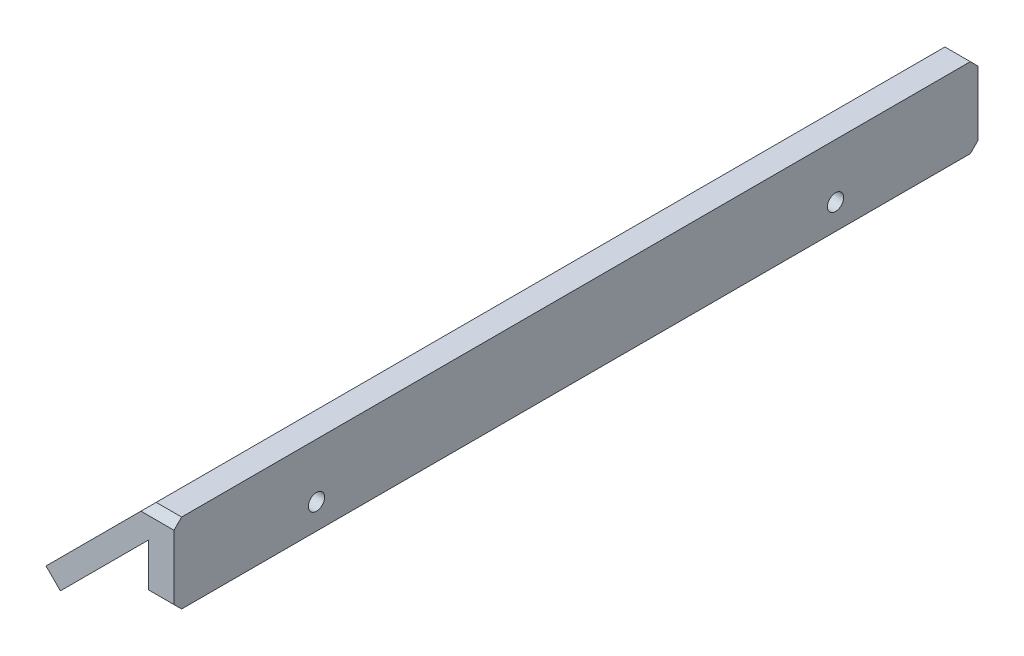
from build123d import *

# Parameters (mm, degrees)
EXTRUDE_1_DEPTH     = 158
SKETCH_2_R          = 1.6
CUT_EXTRUDE_1_DEPTH = 27
SKETCH_6_R          = 3.5
CUT_EXTRUDE_2_DEPTH = 21
SKETCH_7_R          = 2.2
CUT_EXTRUDE_3_DEPTH = 5
CUT_EXTRUDE_4_DEPTH = 10
CUT_EXTRUDE_5_DEPTH = 4


with BuildPart() as part:
    # 草图1 → 凸台-拉伸1 (new body)
    with BuildSketch(Plane.XY):
        Polygon((-43.805178849, 53.227759989), (-48.805178849, 53.227759989), (-70.018382284, 32.014556553), (-67.189955159, 29.186129428), (-48.805178849, 47.570905739), (-48.805178849, 37.570905739), (-43.805178849, 37.570905739), align=None)
    extrude(amount=EXTRUDE_1_DEPTH)

    # 草图2 → 切除-拉伸1 (cut)
    with BuildSketch(Plane(origin=(-43.805178849, 0, 0), x_dir=(0, 0, -1), z_dir=(1, 0, 0))):
        with Locations((-130, 42.570905739)):
            Circle(SKETCH_2_R)
        with Locations((-28, 42.570905739)):
            Circle(SKETCH_2_R)
    extrude(amount=-CUT_EXTRUDE_1_DEPTH, mode=Mode.SUBTRACT)

    # 草图6 → 切除-拉伸2 (cut)
    with BuildSketch(Plane.ZY.offset(48.805178849)):
        with Locations(Location((130, 42.570905739, 0), (0, 0, 90))):
            Circle(SKETCH_6_R)
        with Locations(Location((28, 42.570905739, 0), (0, 0, 90))):
            Circle(SKETCH_6_R)
    extrude(amount=CUT_EXTRUDE_2_DEPTH, mode=Mode.SUBTRACT)

    # 草图7 → 切除-拉伸3 (cut)
    with BuildSketch(Plane(origin=(-51.016469419, 51.016469419, 0), x_dir=(0.7071067811865521, 0.707106781186543, 0), z_dir=(-0.707106781186543, 0.7071067811865521, 0))):
        with Locations(Location((-11.872762886, -148, 0), (0, 0, 180))):
            Circle(SKETCH_7_R)
        with Locations(Location((-11.872762886, -10, 0), (0, 0, 180))):
            Circle(SKETCH_7_R)
    extrude(amount=-CUT_EXTRUDE_3_DEPTH, mode=Mode.SUBTRACT)

    # 草图8 → 切除-拉伸4 (cut)
    with BuildSketch(Plane(origin=(-43.805178849, 0, 0), x_dir=(0, 0, -1), z_dir=(1, 0, 0))):
        Polygon((-158, 53.227759989), (-158, 51.727759989), (-156.5, 53.227759989), align=None)
        Polygon((0, 53.227759989), (-1.5, 53.227759989), (0, 51.727759989), align=None)
        Polygon((-158, 39.070905739), (-158, 37.570905739), (-156.5, 37.570905739), align=None)
        Polygon((0, 37.570905739), (0, 39.070905739), (-1.5, 37.570905739), align=None)
    extrude(amount=-CUT_EXTRUDE_4_DEPTH, mode=Mode.SUBTRACT)

    # 草图9 → 切除-拉伸5 (cut)
    with BuildSketch(Plane(origin=(-48.188042294, 48.188042294, 0), x_dir=(0, 0, -1), z_dir=(0.7071067811865477, -0.7071067811865474, 0))):
        Polygon((-158, -26.872762886), (-158, -25.372762886), (-156.5, -26.872762886), align=None)
        Polygon((0, -26.872762886), (0, -25.372762886), (-1.5, -26.872762886), align=None)
    extrude(amount=-CUT_EXTRUDE_5_DEPTH, mode=Mode.SUBTRACT)


solid = part.part
